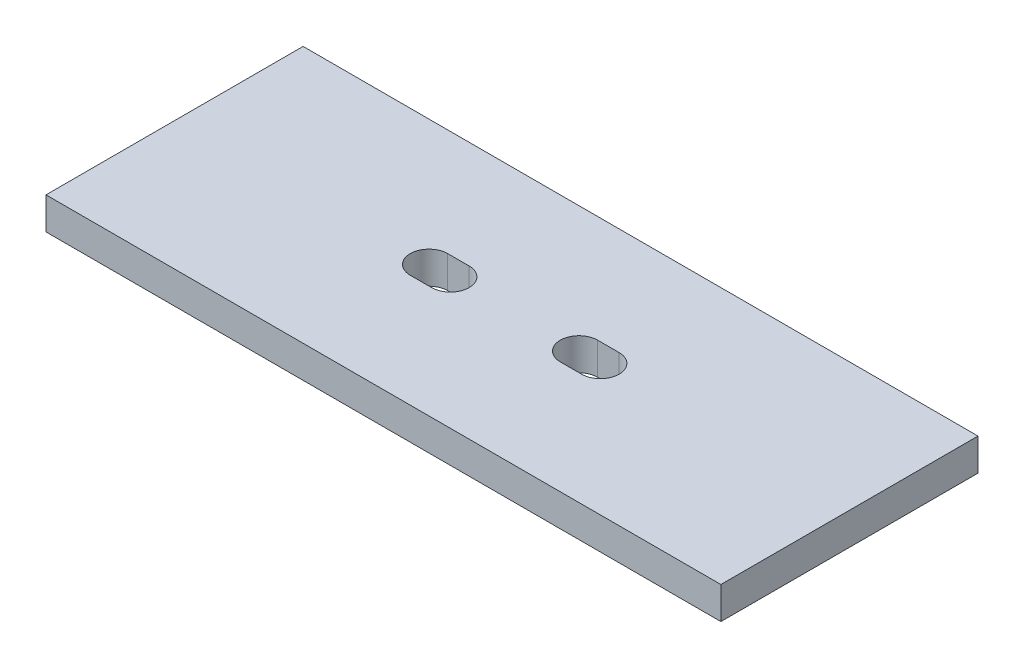
from build123d import *

# Parameters (mm, degrees)
SKETCH_1_W          = 63
SKETCH_1_H          = 24
EXTRUDE_1_DEPTH     = 3
CUT_EXTRUDE_1_DEPTH = 3


with BuildPart() as part:
    # 草图1 → 凸台-拉伸1 (new body)
    with BuildSketch(Plane(origin=(0, 0, 0), x_dir=(1, 0, 0), z_dir=(0, 1, 0))):
        Rectangle(SKETCH_1_W, SKETCH_1_H)
    extrude(amount=EXTRUDE_1_DEPTH)

    # 草图2 → 切除-拉伸1 (cut)
    with BuildSketch(Plane(origin=(0, 3, 0), x_dir=(1, 0, 0), z_dir=(0, 1, 0))):
        with BuildLine():
            Line((-6, -1.5), (-8, -1.5))
            ThreePointArc((-8, -1.5), (-9.75, 0.25), (-8, 2))
            Line((-8, 2), (-6, 2))
            ThreePointArc((-6, 2), (-4.25, 0.25), (-6, -1.5))
        make_face()
        with BuildLine():
            Line((6, 2), (8, 2))
            ThreePointArc((8, 2), (9.75, 0.25), (8, -1.5))
            Line((8, -1.5), (6, -1.5))
            ThreePointArc((6, -1.5), (4.25, 0.25), (6, 2))
        make_face()
    extrude(amount=-CUT_EXTRUDE_1_DEPTH, mode=Mode.SUBTRACT)


solid = part.part
